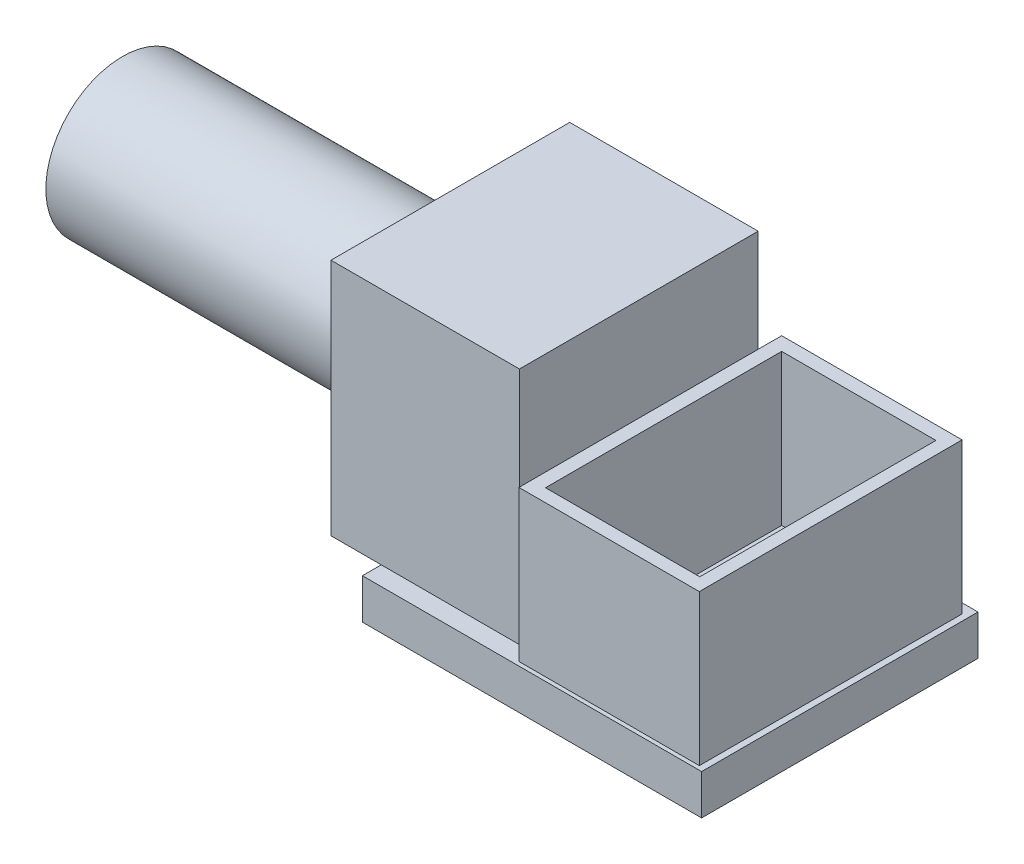
from build123d import *

# Parameters (mm, degrees)
SKETCH_1_W          = 13.5
SKETCH_1_H          = 11
EXTRUDE_1_DEPTH     = 1.6
SKETCH_2_W          = 7.5
SKETCH_2_H          = 9.5
EXTRUDE_2_DEPTH     = 9.5
SKETCH_3_W          = 7.180285824
SKETCH_3_H          = 10.458318516
EXTRUDE_3_DEPTH     = 6
SKETCH_4_W          = 6.139304191
SKETCH_4_H          = 9.400260038
CUT_EXTRUDE_1_DEPTH = 6
SKETCH_5_R          = 3.05
EXTRUDE_4_DEPTH     = 13


with BuildPart() as part:
    # 草图1 → 凸台-拉伸1 (new body)
    with BuildSketch(Plane(origin=(0, 0, 0), x_dir=(1, 0, 0), z_dir=(0, 1, 0))):
        with Locations((-6.339102869, 0.04845815)):
            Rectangle(SKETCH_1_W, SKETCH_1_H)
    extrude(amount=EXTRUDE_1_DEPTH)

    # 草图2 → 凸台-拉伸2 (add)
    with BuildSketch(Plane(origin=(0, 1.6, 0), x_dir=(1, 0, 0), z_dir=(0, 1, 0))):
        with Locations((-11.339102869, 0.04845815)):
            Rectangle(SKETCH_2_W, SKETCH_2_H)
    extrude(amount=EXTRUDE_2_DEPTH)

    # 草图3 → 凸台-拉伸3 (add)
    with BuildSketch(Plane(origin=(0, 1.6, 0), x_dir=(1, 0, 0), z_dir=(0, 1, 0))):
        with Locations((-3.428185131, -0.064528037)):
            Rectangle(SKETCH_3_W, SKETCH_3_H)
    extrude(amount=EXTRUDE_3_DEPTH)

    # 草图4 → 切除-拉伸1 (cut)
    with BuildSketch(Plane(origin=(0, 7.6, 0), x_dir=(1, 0, 0), z_dir=(0, 1, 0))):
        with Locations((-3.408558638, -0.075891751)):
            Rectangle(SKETCH_4_W, SKETCH_4_H)
    extrude(amount=-CUT_EXTRUDE_1_DEPTH, mode=Mode.SUBTRACT)

    # 草图5 → 凸台-拉伸4 (add)
    with BuildSketch(Plane.ZY.offset(15.089102869)):
        with Locations(Location((0, 6.221255945, 0), (0, 0, 180))):
            Circle(SKETCH_5_R)
    extrude(amount=EXTRUDE_4_DEPTH)


solid = part.part
